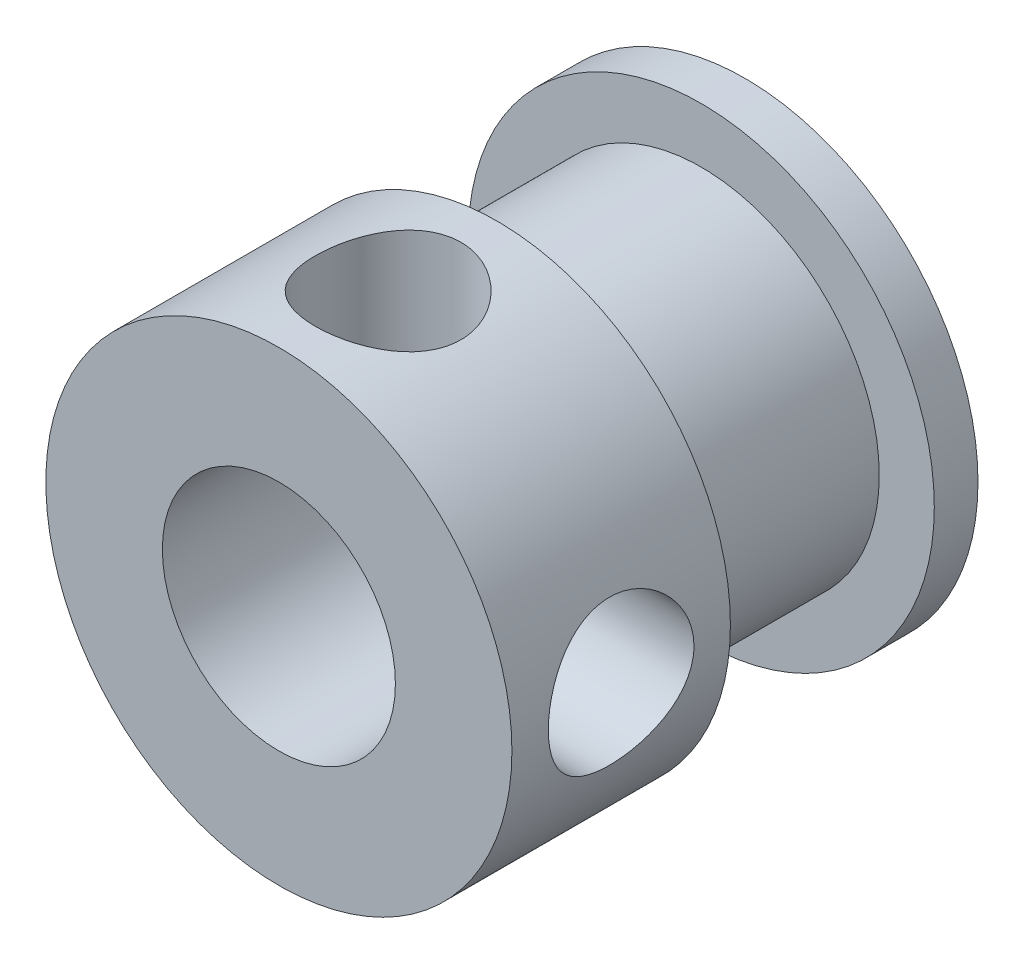
from build123d import *

# Parameters (mm, degrees)
SKETCH1_R               = 8
BOSS_EXTRUDE1_DEPTH     = 1.5
SKETCH2_R               = 6.11
BOSS_EXTRUDE2_DEPTH     = 7
SKETCH4_R               = 8
BOSS_EXTRUDE4_DEPTH     = 7.5
SKETCH6_R               = 4
CUT_EXTRUDE1_DEPTH      = 16
CUT_EXTRUDE2_REACH      = 21.596
CUT_EXTRUDE2_END_RADIUS = 8
SKETCH7_R               = 2.5
CUT_EXTRUDE3_REACH      = 21.596
CUT_EXTRUDE3_END_RADIUS = 8
SKETCH8_R               = 2.5


with BuildPart() as part:
    # Sketch1 → Boss-Extrude1 (new body)
    with BuildSketch(Plane.XY):
        Circle(SKETCH1_R)
    extrude(amount=BOSS_EXTRUDE1_DEPTH)

    # Sketch2 → Boss-Extrude2 (add)
    with BuildSketch(Plane.XY.offset(1.5)):
        Circle(SKETCH2_R)
    extrude(amount=BOSS_EXTRUDE2_DEPTH)

    # Sketch4 → Boss-Extrude4 (add)
    with BuildSketch(Plane.XY.offset(8.5)):
        Circle(SKETCH4_R)
    extrude(amount=BOSS_EXTRUDE4_DEPTH)

    # Sketch6 → Cut-Extrude1 (cut)
    with BuildSketch(Plane.XY.offset(16)):
        Circle(SKETCH6_R)
    extrude(amount=-CUT_EXTRUDE1_DEPTH, mode=Mode.SUBTRACT)

    # Cut-Extrude2: up to this cylinder (the profile starts inside it)
    cut_extrude2_end = Plane(origin=(0, 0, 12.25), z_dir=(0, 0, -1)) * Cylinder(CUT_EXTRUDE2_END_RADIUS, 60.192, mode=Mode.PRIVATE)
    # Sketch7 → Cut-Extrude2 (cut, up to the surface)
    with BuildSketch(Plane.ZY, mode=Mode.PRIVATE) as cut_extrude2_sk1:
        with Locations((12.25, 0)):
            Circle(SKETCH7_R)
    cut_extrude2_tool1 = extrude(cut_extrude2_sk1.sketch, amount=-CUT_EXTRUDE2_REACH, mode=Mode.PRIVATE) & cut_extrude2_end
    add(cut_extrude2_tool1.solids().sort_by_distance((0, 0, 12.25))[0], mode=Mode.SUBTRACT)

    # Cut-Extrude3: up to this cylinder (the profile starts inside it)
    cut_extrude3_end = Plane(origin=(0, 0, 12.25), z_dir=(0, 0, -1)) * Cylinder(CUT_EXTRUDE3_END_RADIUS, 60.192, mode=Mode.PRIVATE)
    # Sketch8 → Cut-Extrude3 (cut, up to the surface)
    with BuildSketch(Plane(origin=(0, 0, 0), x_dir=(0, 0, 1), z_dir=(0, -1, 0)), mode=Mode.PRIVATE) as cut_extrude3_sk1:
        with Locations(Location((12.25, 0, 0), (0, 0, 180))):
            Circle(SKETCH8_R)
    cut_extrude3_tool1 = extrude(cut_extrude3_sk1.sketch, amount=-CUT_EXTRUDE3_REACH, mode=Mode.PRIVATE) & cut_extrude3_end
    add(cut_extrude3_tool1.solids().sort_by_distance((0, 0, 12.25))[0], mode=Mode.SUBTRACT)


solid = part.part
